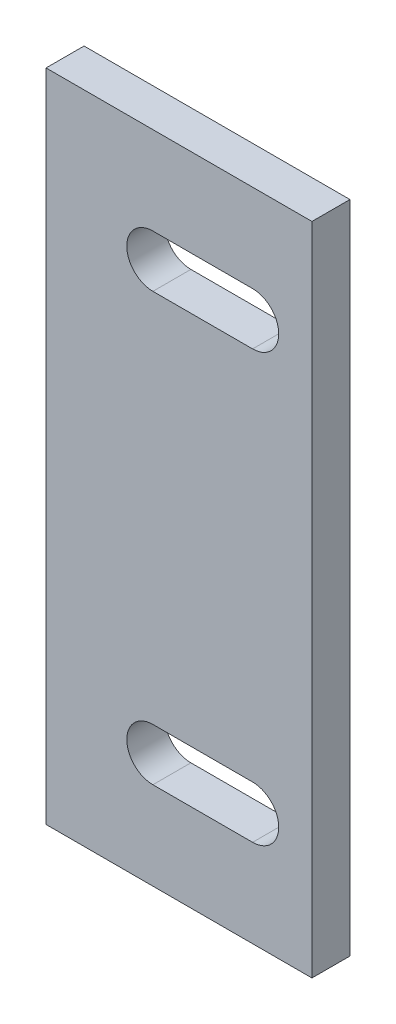
from build123d import *

# Parameters (mm, degrees)
SKETCH1_W           = 28
SKETCH1_H           = 69
BOSS_EXTRUDE1_DEPTH = 4


with BuildPart() as part:
    # Sketch1 → Boss-Extrude1 (new body)
    with BuildSketch(Plane.XY.offset(4)):
        with Locations((14, 0)):
            Rectangle(SKETCH1_W, SKETCH1_H)
        with BuildLine():
            Line((11.25, 25.25), (21.75, 25.25))
            ThreePointArc((21.75, 25.25), (24.5, 22.5), (21.75, 19.75))
            Line((21.75, 19.75), (11.25, 19.75))
            ThreePointArc((11.25, 19.75), (8.5, 22.5), (11.25, 25.25))
        make_face(mode=Mode.SUBTRACT)
        with BuildLine():
            Line((11.25, -19.75), (21.75, -19.75))
            ThreePointArc((21.75, -19.75), (24.5, -22.5), (21.75, -25.25))
            Line((21.75, -25.25), (11.25, -25.25))
            ThreePointArc((11.25, -25.25), (8.5, -22.5), (11.25, -19.75))
        make_face(mode=Mode.SUBTRACT)
    extrude(amount=-BOSS_EXTRUDE1_DEPTH)


solid = part.part
